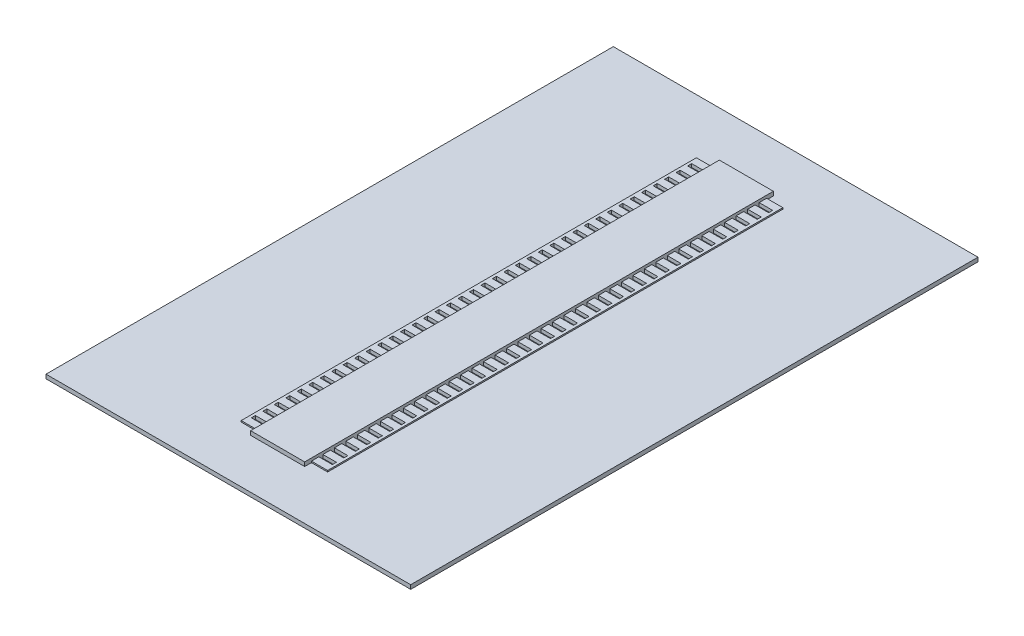
from build123d import *

# Parameters (mm, degrees)
SKETCH1_W           = 27
SKETCH1_H           = 42
BOSS_EXTRUDE1_DEPTH = 0.3
SKETCH2_W           = 4
SKETCH2_H           = 34.7
BOSS_EXTRUDE2_DEPTH = 0.3
SKETCH3_W           = 1.2
SKETCH3_H           = 33.7
BOSS_EXTRUDE4_DEPTH = 0.1
SKETCH8_W           = 1
SKETCH8_H           = 0.3
CUT_EXTRUDE2_DEPTH  = 0.25


with BuildPart() as part:
    # Sketch1 → Boss-Extrude1 (new body)
    with BuildSketch(Plane(origin=(0, 0, 0), x_dir=(1, 0, 0), z_dir=(0, 1, 0))):
        Rectangle(SKETCH1_W, SKETCH1_H)
    extrude(amount=BOSS_EXTRUDE1_DEPTH)

    # Sketch2 → Boss-Extrude2 (add)
    with BuildSketch(Plane(origin=(0, 0.3, 0), x_dir=(1, 0, 0), z_dir=(0, 1, 0))):
        Rectangle(SKETCH2_W, SKETCH2_H)
    extrude(amount=BOSS_EXTRUDE2_DEPTH)

    # Sketch3 → Boss-Extrude4 (add)
    with BuildSketch(Plane(origin=(0, 0.3, 0), x_dir=(1, 0, 0), z_dir=(0, 1, 0))):
        with Locations((2.6, 0)):
            Rectangle(SKETCH3_W, SKETCH3_H)
        with Locations((-2.6, 0)):
            Rectangle(SKETCH3_W, SKETCH3_H)
    extrude(amount=BOSS_EXTRUDE4_DEPTH)

    # Sketch8 → Cut-Extrude2 (cut)
    with BuildSketch(Plane(origin=(0, 0.4, 0), x_dir=(1, 0, 0), z_dir=(0, 1, 0))):
        with Locations((2.5, 16.15)):
            Rectangle(SKETCH8_W, SKETCH8_H)
        with Locations((-2.5, 16.15)):
            Rectangle(SKETCH8_W, SKETCH8_H)
        with Locations((-2.5, 15.3)):
            Rectangle(SKETCH8_W, SKETCH8_H)
        with Locations((-2.5, 14.45)):
            Rectangle(SKETCH8_W, SKETCH8_H)
        with Locations((-2.5, 13.6)):
            Rectangle(SKETCH8_W, SKETCH8_H)
        with Locations((-2.5, 12.75)):
            Rectangle(SKETCH8_W, SKETCH8_H)
        with Locations((-2.5, 11.9)):
            Rectangle(SKETCH8_W, SKETCH8_H)
        with Locations((-2.5, 11.05)):
            Rectangle(SKETCH8_W, SKETCH8_H)
        with Locations((-2.5, 10.2)):
            Rectangle(SKETCH8_W, SKETCH8_H)
        with Locations((-2.5, 9.35)):
            Rectangle(SKETCH8_W, SKETCH8_H)
        with Locations((-2.5, 8.5)):
            Rectangle(SKETCH8_W, SKETCH8_H)
        with Locations((-2.5, 7.65)):
            Rectangle(SKETCH8_W, SKETCH8_H)
        with Locations((-2.5, 6.8)):
            Rectangle(SKETCH8_W, SKETCH8_H)
        with Locations((-2.5, 5.95)):
            Rectangle(SKETCH8_W, SKETCH8_H)
        with Locations((-2.5, 5.1)):
            Rectangle(SKETCH8_W, SKETCH8_H)
        with Locations((-2.5, 4.25)):
            Rectangle(SKETCH8_W, SKETCH8_H)
        with Locations((-2.5, 3.4)):
            Rectangle(SKETCH8_W, SKETCH8_H)
        with Locations((-2.5, 2.55)):
            Rectangle(SKETCH8_W, SKETCH8_H)
        with Locations((-2.5, 1.7)):
            Rectangle(SKETCH8_W, SKETCH8_H)
        with Locations((-2.5, 0.85)):
            Rectangle(SKETCH8_W, SKETCH8_H)
        with Locations((-2.5, 0)):
            Rectangle(SKETCH8_W, SKETCH8_H)
        with Locations((-2.5, -0.85)):
            Rectangle(SKETCH8_W, SKETCH8_H)
        with Locations((-2.5, -1.7)):
            Rectangle(SKETCH8_W, SKETCH8_H)
        with Locations((-2.5, -2.55)):
            Rectangle(SKETCH8_W, SKETCH8_H)
        with Locations((-2.5, -3.4)):
            Rectangle(SKETCH8_W, SKETCH8_H)
        with Locations((-2.5, -4.25)):
            Rectangle(SKETCH8_W, SKETCH8_H)
        with Locations((-2.5, -5.1)):
            Rectangle(SKETCH8_W, SKETCH8_H)
        with Locations((-2.5, -5.95)):
            Rectangle(SKETCH8_W, SKETCH8_H)
        with Locations((-2.5, -6.8)):
            Rectangle(SKETCH8_W, SKETCH8_H)
        with Locations((-2.5, -7.65)):
            Rectangle(SKETCH8_W, SKETCH8_H)
        with Locations((-2.5, -8.5)):
            Rectangle(SKETCH8_W, SKETCH8_H)
        with Locations((-2.5, -9.35)):
            Rectangle(SKETCH8_W, SKETCH8_H)
        with Locations((-2.5, -10.2)):
            Rectangle(SKETCH8_W, SKETCH8_H)
        with Locations((-2.5, -11.05)):
            Rectangle(SKETCH8_W, SKETCH8_H)
        with Locations((-2.5, -11.9)):
            Rectangle(SKETCH8_W, SKETCH8_H)
        with Locations((-2.5, -12.75)):
            Rectangle(SKETCH8_W, SKETCH8_H)
        with Locations((-2.5, -13.6)):
            Rectangle(SKETCH8_W, SKETCH8_H)
        with Locations((-2.5, -14.45)):
            Rectangle(SKETCH8_W, SKETCH8_H)
        with Locations((-2.5, -15.3)):
            Rectangle(SKETCH8_W, SKETCH8_H)
        with Locations((-2.5, -16.15)):
            Rectangle(SKETCH8_W, SKETCH8_H)
        with Locations((2.5, 15.3)):
            Rectangle(SKETCH8_W, SKETCH8_H)
        with Locations((2.5, 14.45)):
            Rectangle(SKETCH8_W, SKETCH8_H)
        with Locations((2.5, 13.6)):
            Rectangle(SKETCH8_W, SKETCH8_H)
        with Locations((2.5, 12.75)):
            Rectangle(SKETCH8_W, SKETCH8_H)
        with Locations((2.5, 11.9)):
            Rectangle(SKETCH8_W, SKETCH8_H)
        with Locations((2.5, 11.05)):
            Rectangle(SKETCH8_W, SKETCH8_H)
        with Locations((2.5, 10.2)):
            Rectangle(SKETCH8_W, SKETCH8_H)
        with Locations((2.5, 9.35)):
            Rectangle(SKETCH8_W, SKETCH8_H)
        with Locations((2.5, 8.5)):
            Rectangle(SKETCH8_W, SKETCH8_H)
        with Locations((2.5, 7.65)):
            Rectangle(SKETCH8_W, SKETCH8_H)
        with Locations((2.5, 6.8)):
            Rectangle(SKETCH8_W, SKETCH8_H)
        with Locations((2.5, 5.95)):
            Rectangle(SKETCH8_W, SKETCH8_H)
        with Locations((2.5, 5.1)):
            Rectangle(SKETCH8_W, SKETCH8_H)
        with Locations((2.5, 4.25)):
            Rectangle(SKETCH8_W, SKETCH8_H)
        with Locations((2.5, 3.4)):
            Rectangle(SKETCH8_W, SKETCH8_H)
        with Locations((2.5, 2.55)):
            Rectangle(SKETCH8_W, SKETCH8_H)
        with Locations((2.5, 1.7)):
            Rectangle(SKETCH8_W, SKETCH8_H)
        with Locations((2.5, 0.85)):
            Rectangle(SKETCH8_W, SKETCH8_H)
        with Locations((2.5, 0)):
            Rectangle(SKETCH8_W, SKETCH8_H)
        with Locations((2.5, -0.85)):
            Rectangle(SKETCH8_W, SKETCH8_H)
        with Locations((2.5, -1.7)):
            Rectangle(SKETCH8_W, SKETCH8_H)
        with Locations((2.5, -2.55)):
            Rectangle(SKETCH8_W, SKETCH8_H)
        with Locations((2.5, -3.4)):
            Rectangle(SKETCH8_W, SKETCH8_H)
        with Locations((2.5, -4.25)):
            Rectangle(SKETCH8_W, SKETCH8_H)
        with Locations((2.5, -5.1)):
            Rectangle(SKETCH8_W, SKETCH8_H)
        with Locations((2.5, -5.95)):
            Rectangle(SKETCH8_W, SKETCH8_H)
        with Locations((2.5, -6.8)):
            Rectangle(SKETCH8_W, SKETCH8_H)
        with Locations((2.5, -7.65)):
            Rectangle(SKETCH8_W, SKETCH8_H)
        with Locations((2.5, -8.5)):
            Rectangle(SKETCH8_W, SKETCH8_H)
        with Locations((2.5, -9.35)):
            Rectangle(SKETCH8_W, SKETCH8_H)
        with Locations((2.5, -10.2)):
            Rectangle(SKETCH8_W, SKETCH8_H)
        with Locations((2.5, -11.05)):
            Rectangle(SKETCH8_W, SKETCH8_H)
        with Locations((2.5, -11.9)):
            Rectangle(SKETCH8_W, SKETCH8_H)
        with Locations((2.5, -12.75)):
            Rectangle(SKETCH8_W, SKETCH8_H)
        with Locations((2.5, -13.6)):
            Rectangle(SKETCH8_W, SKETCH8_H)
        with Locations((2.5, -14.45)):
            Rectangle(SKETCH8_W, SKETCH8_H)
        with Locations((2.5, -15.3)):
            Rectangle(SKETCH8_W, SKETCH8_H)
        with Locations((2.5, -16.15)):
            Rectangle(SKETCH8_W, SKETCH8_H)
    extrude(amount=-CUT_EXTRUDE2_DEPTH, mode=Mode.SUBTRACT)


solid = part.part
